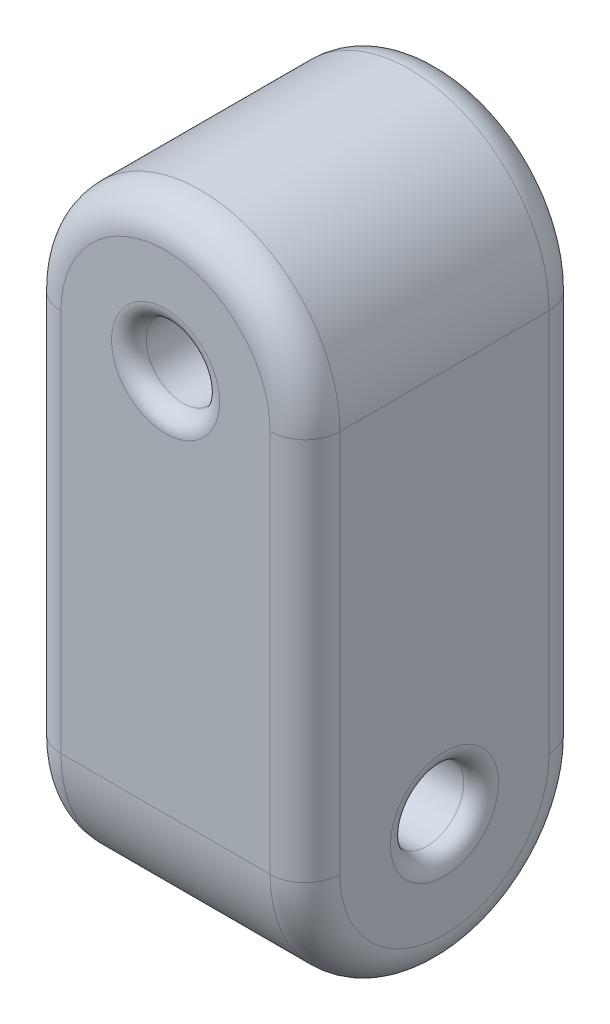
from build123d import *

# Parameters (mm, degrees)
BOSS_EXTRUDE1_START = 0.8
SKETCH2_R           = 4
BOSS_EXTRUDE1_DEPTH = 8
SKETCH10_W          = 8
SKETCH10_H          = 11
BOSS_EXTRUDE2_DEPTH = 8
BOSS_EXTRUDE3_START = 4
SKETCH8_R           = 4
BOSS_EXTRUDE3_DEPTH = 8
SKETCH1_R           = 1.05
CUT_EXTRUDE2_DEPTH  = 9.6
CUT_EXTRUDE3_START  = 4.975
SKETCH9_R           = 1.05
CUT_EXTRUDE3_DEPTH  = 9.95
FILLET1_R           = 1
FILLET2_R           = 0.5


with BuildPart() as part:
    # Sketch2 → Boss-Extrude1 (new body)
    with BuildSketch(Plane.XY.offset(BOSS_EXTRUDE1_START)):
        Circle(SKETCH2_R)
    extrude(amount=BOSS_EXTRUDE1_DEPTH)

    # Sketch10 → Boss-Extrude2 (add)
    with BuildSketch(Plane(origin=(0, 0, 0.8), x_dir=(-1, 0, 0), z_dir=(0, 0, -1))):
        with Locations((0, -5.5)):
            Rectangle(SKETCH10_W, SKETCH10_H)
    extrude(amount=-BOSS_EXTRUDE2_DEPTH)

    # Sketch8 → Boss-Extrude3 (add)
    with BuildSketch(Plane(origin=(0, 0, 0), x_dir=(0, 0, -1), z_dir=(1, 0, 0)).offset(BOSS_EXTRUDE3_START)):
        with Locations((-4.8, -11)):
            Circle(SKETCH8_R)
    extrude(amount=-BOSS_EXTRUDE3_DEPTH)

    # Sketch1 → Cut-Extrude2 (cut)
    with BuildSketch(Plane.XY):
        Circle(SKETCH1_R)
    extrude(amount=CUT_EXTRUDE2_DEPTH, mode=Mode.SUBTRACT)

    # Sketch9 → Cut-Extrude3 (cut)
    with BuildSketch(Plane(origin=(0, 0, 0), x_dir=(0, 0, -1), z_dir=(1, 0, 0)).offset(CUT_EXTRUDE3_START)):
        with Locations((-4.8, -11)):
            Circle(SKETCH9_R)
    extrude(amount=-CUT_EXTRUDE3_DEPTH, mode=Mode.SUBTRACT)

    # Fillet1
    fillet1_edges = [part.edges().sort_by_distance(p)[0] for p in [
        (-4, -5.5, 8.8),
        (4, -5.5, 0.8),
        (0, 4, 0.8),
        (-4, -15, 4.8),
        (4, -15, 4.8),
        (0, 4, 8.8),
        (-4, -5.5, 0.8),
        (4, -5.5, 8.8),
    ]]
    fillet(fillet1_edges, radius=FILLET1_R)

    # Fillet2
    fillet2_edges = [part.edges().sort_by_distance(p)[0] for p in [
        (-1.05, 0, 8.8),
        (-1.05, 0, 0.8),
        (-4, -11, 5.85),
        (4, -11, 5.85),
    ]]
    fillet(fillet2_edges, radius=FILLET2_R)


solid = part.part
